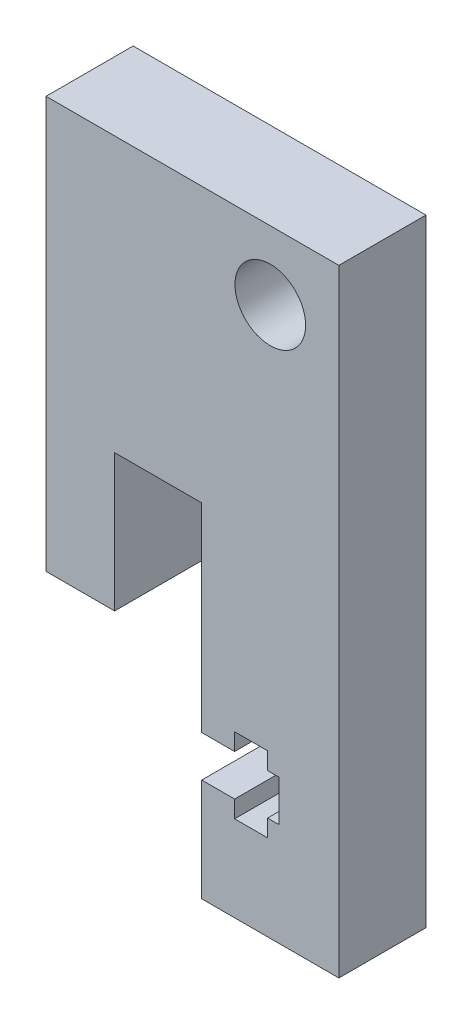
from build123d import *

# Parameters (mm, degrees)
SKETCH1_R           = 2.575
BOSS_EXTRUDE1_DEPTH = 6.35


with BuildPart() as part:
    # Sketch1 → Boss-Extrude1 (new body)
    with BuildSketch(Plane.XY):
        Polygon((8.540553214, -10.783269704), (8.540553214, 34.216730296), (-12.809446786, 34.216730296), (-12.809446786, 4.216730296), (-7.809446786, 4.216730296), (-7.809446786, 14.216730296), (-1.459446786, 14.216730296), (-1.459446786, -0.283269704), (0.940553214, -0.283269704), (0.940553214, 0.966730296), (3.340553214, 0.966730296), (3.340553214, -0.283269704), (4.190553214, -0.283269704), (4.190553214, -3.283269704), (3.340553214, -3.283269704), (3.340553214, -4.533269704), (0.940553214, -4.533269704), (0.940553214, -3.283269704), (-1.459446786, -3.283269704), (-1.459446786, -10.783269704), align=None)
        with Locations((3.540553214, 29.216730296)):
            Circle(SKETCH1_R, mode=Mode.SUBTRACT)
    extrude(amount=BOSS_EXTRUDE1_DEPTH)


solid = part.part
